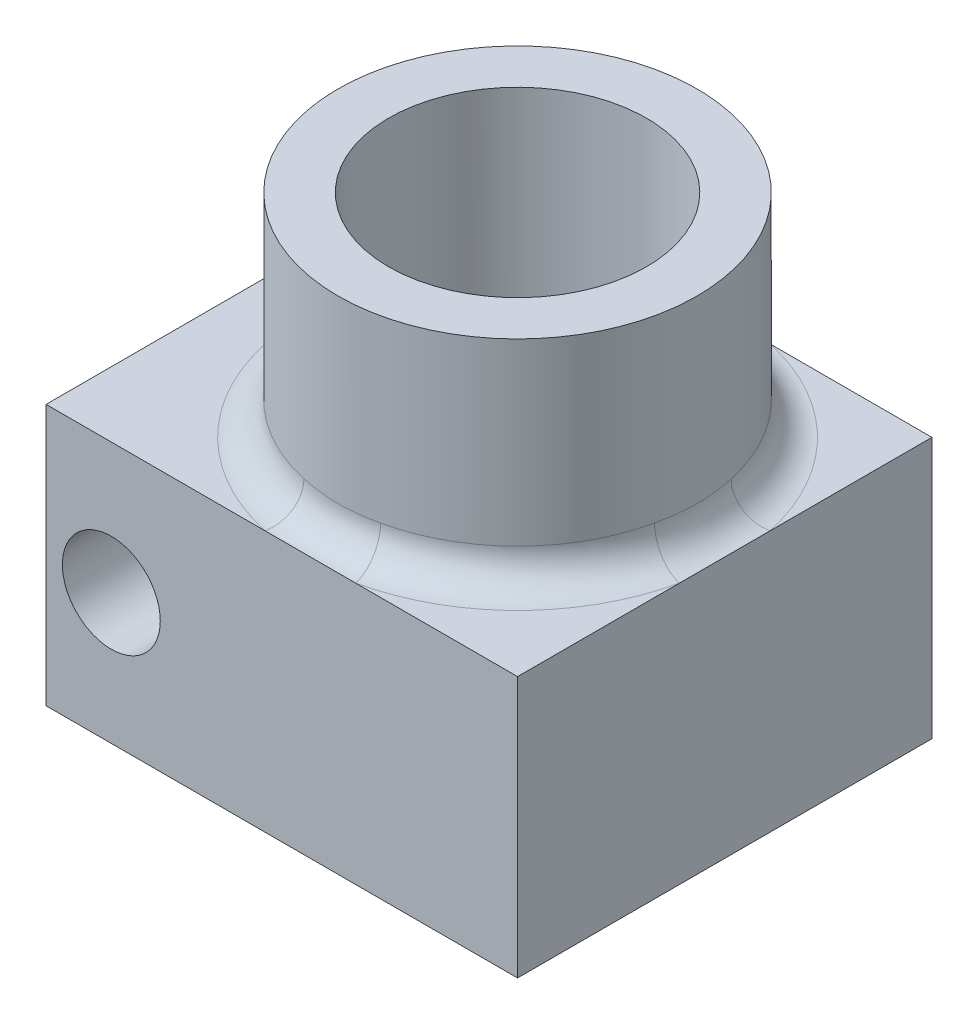
from build123d import *
from build123d.topology import SkipClean

# Parameters (mm, degrees)
BOSS_EXTRUDE1_DEPTH = 16
SKETCH2_R           = 11
SKETCH2_R_2         = 7.9
BOSS_EXTRUDE2_DEPTH = 13
FILLET1_R           = 2
SKETCH3_R           = 3
CUT_EXTRUDE1_DEPTH  = 30


with BuildPart() as part:
    # Sketch1 → Boss-Extrude1 (new body)
    with BuildSketch(Plane(origin=(0, 0, 0), x_dir=(1, 0, 0), z_dir=(0, 1, 0))):
        Polygon((-8.647047276, 8.462822152), (16.752952724, 8.462822152), (16.752952724, -16.937177848), (-8.647047276, -16.937177848), (-10.397047276, -16.937177848), (-12.147047276, -16.937177848), (-12.147047276, 8.462822152), (-10.397047276, 8.462822152), align=None)
        with BuildLine():
            ThreePointArc((1.765866269, 3.324517435), (1.742862266, 2.858921133), (1.833527089, 2.401658636))
            ThreePointArc((1.833527089, 2.401658636), (1.65881172, 2.340670498), (1.485769564, 2.275085248))
            ThreePointArc((1.485769564, 2.275085248), (1.261300181, 2.683646868), (0.944398557, 3.02552764))
            ThreePointArc((0.944398557, 3.02552764), (0.714268456, 2.92265367), (0.487537646, 2.812489898))
            ThreePointArc((0.487537646, 2.812489898), (0.545733074, 2.349972446), (0.714423294, 1.915400575))
            ThreePointArc((0.714423294, 1.915400575), (0.552952724, 1.824999979), (0.393928226, 1.730362661))
            ThreePointArc((0.393928226, 1.730362661), (0.101923056, 2.093738613), (-0.269531093, 2.375396058))
            ThreePointArc((-0.269531093, 2.375396058), (-0.478301123, 2.234123302), (-0.682457645, 2.086261773))
            ThreePointArc((-0.682457645, 2.086261773), (-0.544831023, 1.640876531), (-0.303240973, 1.242199533))
            ThreePointArc((-0.303240973, 1.242199533), (-0.446560544, 1.125133254), (-0.586735505, 1.004319376))
            ThreePointArc((-0.586735505, 1.004319376), (-0.937404032, 1.311468664), (-1.35212426, 1.524344764))
            ThreePointArc((-1.35212426, 1.524344764), (-1.533190848, 1.348965724), (-1.708569888, 1.167899136))
            ThreePointArc((-1.708569888, 1.167899136), (-1.495693788, 0.753178908), (-1.188544499, 0.402510381))
            ThreePointArc((-1.188544499, 0.402510381), (-1.309358378, 0.26233542), (-1.426424657, 0.119015849))
            ThreePointArc((-1.426424657, 0.119015849), (-1.825101655, 0.3606059), (-2.270486897, 0.498232521))
            ThreePointArc((-2.270486897, 0.498232521), (-2.418348426, 0.294076), (-2.559621182, 0.085305969))
            ThreePointArc((-2.559621182, 0.085305969), (-2.277963736, -0.28614818), (-1.914587785, -0.578153349))
            ThreePointArc((-1.914587785, -0.578153349), (-2.009225103, -0.737177848), (-2.099625699, -0.898648418))
            ThreePointArc((-2.099625699, -0.898648418), (-2.53419757, -0.729958198), (-2.996715022, -0.67176277))
            ThreePointArc((-2.996715022, -0.67176277), (-3.106878794, -0.89849358), (-3.209752763, -1.128623681))
            ThreePointArc((-3.209752763, -1.128623681), (-2.867871992, -1.445525304), (-2.459310372, -1.669994688))
            ThreePointArc((-2.459310372, -1.669994688), (-2.524895622, -1.843036844), (-2.58588376, -2.017752213))
            ThreePointArc((-2.58588376, -2.017752213), (-3.043146256, -1.927087389), (-3.508742559, -1.950091393))
            ThreePointArc((-3.508742559, -1.950091393), (-3.577861304, -2.192507391), (-3.639210714, -2.437005176))
            ThreePointArc((-3.639210714, -2.437005176), (-3.24749449, -2.689725379), (-2.80616114, -2.839838587))
            ThreePointArc((-2.80616114, -2.839838587), (-2.840701547, -3.021640604), (-2.870424133, -3.204292132))
            ThreePointArc((-2.870424133, -3.204292132), (-3.336483566, -3.194407511), (-3.791011812, -3.297911981))
            ThreePointArc((-3.791011812, -3.297911981), (-3.816985391, -3.54864748), (-3.834946171, -3.800084007))
            ThreePointArc((-3.834946171, -3.800084007), (-3.405296594, -3.980944014), (-2.944601204, -4.052139933))
            ThreePointArc((-2.944601204, -4.052139933), (-2.947047276, -4.237177848), (-2.944601204, -4.422215762))
            ThreePointArc((-2.944601204, -4.422215762), (-3.405296594, -4.493411681), (-3.834946171, -4.674271688))
            ThreePointArc((-3.834946171, -4.674271688), (-3.816985391, -4.925708215), (-3.791011812, -5.176443714))
            ThreePointArc((-3.791011812, -5.176443714), (-3.336483566, -5.279948184), (-2.870424133, -5.270063563))
            ThreePointArc((-2.870424133, -5.270063563), (-2.840701547, -5.452715091), (-2.80616114, -5.634517108))
            ThreePointArc((-2.80616114, -5.634517108), (-3.24749449, -5.784630316), (-3.639210714, -6.037350519))
            ThreePointArc((-3.639210714, -6.037350519), (-3.577861304, -6.281848304), (-3.508742559, -6.524264302))
            ThreePointArc((-3.508742559, -6.524264302), (-3.043146256, -6.547268306), (-2.58588376, -6.456603482))
            ThreePointArc((-2.58588376, -6.456603482), (-2.524895622, -6.631318851), (-2.459310372, -6.804361007))
            ThreePointArc((-2.459310372, -6.804361007), (-2.867871992, -7.028830391), (-3.209752763, -7.345732014))
            ThreePointArc((-3.209752763, -7.345732014), (-3.106878794, -7.575862115), (-2.996715022, -7.802592926))
            ThreePointArc((-2.996715022, -7.802592926), (-2.53419757, -7.744397497), (-2.099625699, -7.575707277))
            ThreePointArc((-2.099625699, -7.575707277), (-2.009225103, -7.737177848), (-1.914587785, -7.896202346))
            ThreePointArc((-1.914587785, -7.896202346), (-2.277963736, -8.188207515), (-2.559621182, -8.559661664))
            ThreePointArc((-2.559621182, -8.559661664), (-2.418348426, -8.768431695), (-2.270486897, -8.972588216))
            ThreePointArc((-2.270486897, -8.972588216), (-1.825101655, -8.834961595), (-1.426424657, -8.593371544))
            ThreePointArc((-1.426424657, -8.593371544), (-1.309358378, -8.736691115), (-1.188544499, -8.876866076))
            ThreePointArc((-1.188544499, -8.876866076), (-1.495693788, -9.227534603), (-1.708569888, -9.642254831))
            ThreePointArc((-1.708569888, -9.642254831), (-1.533190848, -9.823321419), (-1.35212426, -9.998700459))
            ThreePointArc((-1.35212426, -9.998700459), (-0.937404032, -9.785824359), (-0.586735505, -9.478675071))
            ThreePointArc((-0.586735505, -9.478675071), (-0.446560544, -9.599488949), (-0.303240973, -9.716555228))
            ThreePointArc((-0.303240973, -9.716555228), (-0.544831023, -10.115232226), (-0.682457645, -10.560617469))
            ThreePointArc((-0.682457645, -10.560617469), (-0.478301123, -10.708478997), (-0.269531093, -10.849751753))
            ThreePointArc((-0.269531093, -10.849751753), (0.101923056, -10.568094308), (0.393928226, -10.204718356))
            ThreePointArc((0.393928226, -10.204718356), (0.552952724, -10.299355674), (0.714423294, -10.38975627))
            ThreePointArc((0.714423294, -10.38975627), (0.545733074, -10.824328141), (0.487537646, -11.286845593))
            ThreePointArc((0.487537646, -11.286845593), (0.714268456, -11.397009365), (0.944398557, -11.499883335))
            ThreePointArc((0.944398557, -11.499883335), (1.261300181, -11.158002563), (1.485769564, -10.749440943))
            ThreePointArc((1.485769564, -10.749440943), (1.65881172, -10.815026193), (1.833527089, -10.876014331))
            ThreePointArc((1.833527089, -10.876014331), (1.742862266, -11.333276828), (1.765866269, -11.79887313))
            ThreePointArc((1.765866269, -11.79887313), (2.008282267, -11.867991875), (2.252780052, -11.929341285))
            ThreePointArc((2.252780052, -11.929341285), (2.505500255, -11.537625061), (2.655613464, -11.096291711))
            ThreePointArc((2.655613464, -11.096291711), (2.83741548, -11.130832119), (3.020067009, -11.160554704))
            ThreePointArc((3.020067009, -11.160554704), (3.010182387, -11.626614138), (3.113686858, -12.081142383))
            ThreePointArc((3.113686858, -12.081142383), (3.364422356, -12.107115962), (3.615858884, -12.125076742))
            ThreePointArc((3.615858884, -12.125076742), (3.79671889, -11.695427165), (3.86791481, -11.234731775))
            ThreePointArc((3.86791481, -11.234731775), (4.052952724, -11.237177848), (4.237990638, -11.234731775))
            ThreePointArc((4.237990638, -11.234731775), (4.309186557, -11.695427165), (4.490046564, -12.125076742))
            ThreePointArc((4.490046564, -12.125076742), (4.741483091, -12.107115962), (4.99221859, -12.081142383))
            ThreePointArc((4.99221859, -12.081142383), (5.095723061, -11.626614138), (5.085838439, -11.160554704))
            ThreePointArc((5.085838439, -11.160554704), (5.268489967, -11.130832119), (5.450291984, -11.096291711))
            ThreePointArc((5.450291984, -11.096291711), (5.600405192, -11.537625061), (5.853125395, -11.929341285))
            ThreePointArc((5.853125395, -11.929341285), (6.09762318, -11.867991875), (6.340039178, -11.79887313))
            ThreePointArc((6.340039178, -11.79887313), (6.363043182, -11.333276828), (6.272378358, -10.876014331))
            ThreePointArc((6.272378358, -10.876014331), (6.447093727, -10.815026193), (6.620135884, -10.749440943))
            ThreePointArc((6.620135884, -10.749440943), (6.844605267, -11.158002563), (7.16150689, -11.499883335))
            ThreePointArc((7.16150689, -11.499883335), (7.391636991, -11.397009365), (7.618367802, -11.286845593))
            ThreePointArc((7.618367802, -11.286845593), (7.560172373, -10.824328141), (7.391482153, -10.38975627))
            ThreePointArc((7.391482153, -10.38975627), (7.552952724, -10.299355674), (7.711977222, -10.204718356))
            ThreePointArc((7.711977222, -10.204718356), (8.003982392, -10.568094308), (8.375436541, -10.849751753))
            ThreePointArc((8.375436541, -10.849751753), (8.584206571, -10.708478997), (8.788363092, -10.560617469))
            ThreePointArc((8.788363092, -10.560617469), (8.650736471, -10.115232226), (8.409146421, -9.716555228))
            ThreePointArc((8.409146421, -9.716555228), (8.552465992, -9.599488949), (8.692640952, -9.478675071))
            ThreePointArc((8.692640952, -9.478675071), (9.043309479, -9.785824359), (9.458029707, -9.998700459))
            ThreePointArc((9.458029707, -9.998700459), (9.639096295, -9.823321419), (9.814475335, -9.642254831))
            ThreePointArc((9.814475335, -9.642254831), (9.601599236, -9.227534603), (9.294449947, -8.876866076))
            ThreePointArc((9.294449947, -8.876866076), (9.415263826, -8.736691115), (9.532330104, -8.593371544))
            ThreePointArc((9.532330104, -8.593371544), (9.931007102, -8.834961595), (10.376392345, -8.972588216))
            ThreePointArc((10.376392345, -8.972588216), (10.524253874, -8.768431695), (10.665526629, -8.559661664))
            ThreePointArc((10.665526629, -8.559661664), (10.383869184, -8.188207515), (10.020493232, -7.896202346))
            ThreePointArc((10.020493232, -7.896202346), (10.11513055, -7.737177848), (10.205531147, -7.575707277))
            ThreePointArc((10.205531147, -7.575707277), (10.640103017, -7.744397497), (11.102620469, -7.802592926))
            ThreePointArc((11.102620469, -7.802592926), (11.212784241, -7.575862115), (11.315658211, -7.345732014))
            ThreePointArc((11.315658211, -7.345732014), (10.973777439, -7.028830391), (10.565215819, -6.804361007))
            ThreePointArc((10.565215819, -6.804361007), (10.630801069, -6.631318851), (10.691789207, -6.456603482))
            ThreePointArc((10.691789207, -6.456603482), (11.149051704, -6.547268306), (11.614648007, -6.524264302))
            ThreePointArc((11.614648007, -6.524264302), (11.683766751, -6.281848304), (11.745116161, -6.037350519))
            ThreePointArc((11.745116161, -6.037350519), (11.353399937, -5.784630316), (10.912066587, -5.634517108))
            ThreePointArc((10.912066587, -5.634517108), (10.946606995, -5.452715091), (10.97632958, -5.270063563))
            ThreePointArc((10.97632958, -5.270063563), (11.442389014, -5.279948184), (11.896917259, -5.176443714))
            ThreePointArc((11.896917259, -5.176443714), (11.922890839, -4.925708215), (11.940851619, -4.674271688))
            ThreePointArc((11.940851619, -4.674271688), (11.511202041, -4.493411681), (11.050506651, -4.422215762))
            ThreePointArc((11.050506651, -4.422215762), (11.052952724, -4.237177848), (11.050506651, -4.052139933))
            ThreePointArc((11.050506651, -4.052139933), (11.511202041, -3.980944014), (11.940851619, -3.800084007))
            ThreePointArc((11.940851619, -3.800084007), (11.922890839, -3.54864748), (11.896917259, -3.297911981))
            ThreePointArc((11.896917259, -3.297911981), (11.442389014, -3.194407511), (10.97632958, -3.204292132))
            ThreePointArc((10.97632958, -3.204292132), (10.946606995, -3.021640604), (10.912066587, -2.839838587))
            ThreePointArc((10.912066587, -2.839838587), (11.353399937, -2.689725379), (11.745116161, -2.437005176))
            ThreePointArc((11.745116161, -2.437005176), (11.683766751, -2.192507391), (11.614648007, -1.950091393))
            ThreePointArc((11.614648007, -1.950091393), (11.149051704, -1.927087389), (10.691789207, -2.017752213))
            ThreePointArc((10.691789207, -2.017752213), (10.630801069, -1.843036844), (10.565215819, -1.669994688))
            ThreePointArc((10.565215819, -1.669994688), (10.973777439, -1.445525304), (11.315658211, -1.128623681))
            ThreePointArc((11.315658211, -1.128623681), (11.212784241, -0.89849358), (11.102620469, -0.67176277))
            ThreePointArc((11.102620469, -0.67176277), (10.640103017, -0.729958198), (10.205531147, -0.898648418))
            ThreePointArc((10.205531147, -0.898648418), (10.11513055, -0.737177848), (10.020493232, -0.578153349))
            ThreePointArc((10.020493232, -0.578153349), (10.383869184, -0.28614818), (10.665526629, 0.085305969))
            ThreePointArc((10.665526629, 0.085305969), (10.524253874, 0.294076), (10.376392345, 0.498232521))
            ThreePointArc((10.376392345, 0.498232521), (9.931007102, 0.3606059), (9.532330104, 0.119015849))
            ThreePointArc((9.532330104, 0.119015849), (9.415263826, 0.26233542), (9.294449947, 0.402510381))
            ThreePointArc((9.294449947, 0.402510381), (9.601599236, 0.753178908), (9.814475335, 1.167899136))
            ThreePointArc((9.814475335, 1.167899136), (9.639096295, 1.348965724), (9.458029707, 1.524344764))
            ThreePointArc((9.458029707, 1.524344764), (9.043309479, 1.311468664), (8.692640952, 1.004319376))
            ThreePointArc((8.692640952, 1.004319376), (8.552465992, 1.125133254), (8.409146421, 1.242199533))
            ThreePointArc((8.409146421, 1.242199533), (8.650736471, 1.640876531), (8.788363092, 2.086261773))
            ThreePointArc((8.788363092, 2.086261773), (8.584206571, 2.234123302), (8.375436541, 2.375396058))
            ThreePointArc((8.375436541, 2.375396058), (8.003982392, 2.093738613), (7.711977222, 1.730362661))
            ThreePointArc((7.711977222, 1.730362661), (7.552952724, 1.824999979), (7.391482153, 1.915400575))
            ThreePointArc((7.391482153, 1.915400575), (7.560172373, 2.349972446), (7.618367802, 2.812489898))
            ThreePointArc((7.618367802, 2.812489898), (7.391636991, 2.92265367), (7.16150689, 3.02552764))
            ThreePointArc((7.16150689, 3.02552764), (6.844605267, 2.683646868), (6.620135884, 2.275085248))
            ThreePointArc((6.620135884, 2.275085248), (6.447093727, 2.340670498), (6.272378358, 2.401658636))
            ThreePointArc((6.272378358, 2.401658636), (6.363043182, 2.858921133), (6.340039178, 3.324517435))
            ThreePointArc((6.340039178, 3.324517435), (6.09762318, 3.39363618), (5.853125395, 3.45498559))
            ThreePointArc((5.853125395, 3.45498559), (5.600405192, 3.063269366), (5.450291984, 2.621936016))
            ThreePointArc((5.450291984, 2.621936016), (5.268489967, 2.656476424), (5.085838439, 2.686199009))
            ThreePointArc((5.085838439, 2.686199009), (5.095723061, 3.152258443), (4.99221859, 3.606786688))
            ThreePointArc((4.99221859, 3.606786688), (4.741483091, 3.632760267), (4.490046564, 3.650721047))
            ThreePointArc((4.490046564, 3.650721047), (4.309186557, 3.22107147), (4.237990638, 2.76037608))
            ThreePointArc((4.237990638, 2.76037608), (4.052952724, 2.762822152), (3.86791481, 2.76037608))
            ThreePointArc((3.86791481, 2.76037608), (3.79671889, 3.22107147), (3.615858884, 3.650721047))
            ThreePointArc((3.615858884, 3.650721047), (3.364422356, 3.632760267), (3.113686858, 3.606786688))
            ThreePointArc((3.113686858, 3.606786688), (3.010182387, 3.152258443), (3.020067009, 2.686199009))
            ThreePointArc((3.020067009, 2.686199009), (2.83741548, 2.656476424), (2.655613464, 2.621936016))
            ThreePointArc((2.655613464, 2.621936016), (2.505500255, 3.063269366), (2.252780052, 3.45498559))
            ThreePointArc((2.252780052, 3.45498559), (2.008282267, 3.39363618), (1.765866269, 3.324517435))
        make_face(mode=Mode.SUBTRACT)
    extrude(amount=BOSS_EXTRUDE1_DEPTH)

    # Sketch2 → Boss-Extrude2 (add)
    with SkipClean():  # the faces are left unmerged after this step: merging them gives an invalid solid
        with BuildSketch(Plane(origin=(0, 16, 0), x_dir=(1, 0, 0), z_dir=(0, 1, 0))):
            with Locations(Location((4.052952724, -4.237177848, 0), (0, 0, 90))):
                Circle(SKETCH2_R)
            with Locations(Location((4.052952724, -4.237177848, 0), (0, 0, 86.828300343))):
                Circle(SKETCH2_R_2, mode=Mode.SUBTRACT)
        extrude(amount=BOSS_EXTRUDE2_DEPTH)

    # Fillet1
    fillet1_edges = [part.edges().sort_by_distance(p)[0] for p in [
        (4.052952724, 16, 15.237177848),
    ]]
    fillet(fillet1_edges, radius=FILLET1_R)

    # Sketch3 → Cut-Extrude1 (cut)
    with SkipClean():  # the faces are left unmerged after this step: merging them gives an invalid solid
        with BuildSketch(Plane.XY.offset(16.937177848)):
            with Locations((-8.147047276, 8)):
                Circle(SKETCH3_R)
        extrude(amount=-CUT_EXTRUDE1_DEPTH, mode=Mode.SUBTRACT)


solid = part.part
